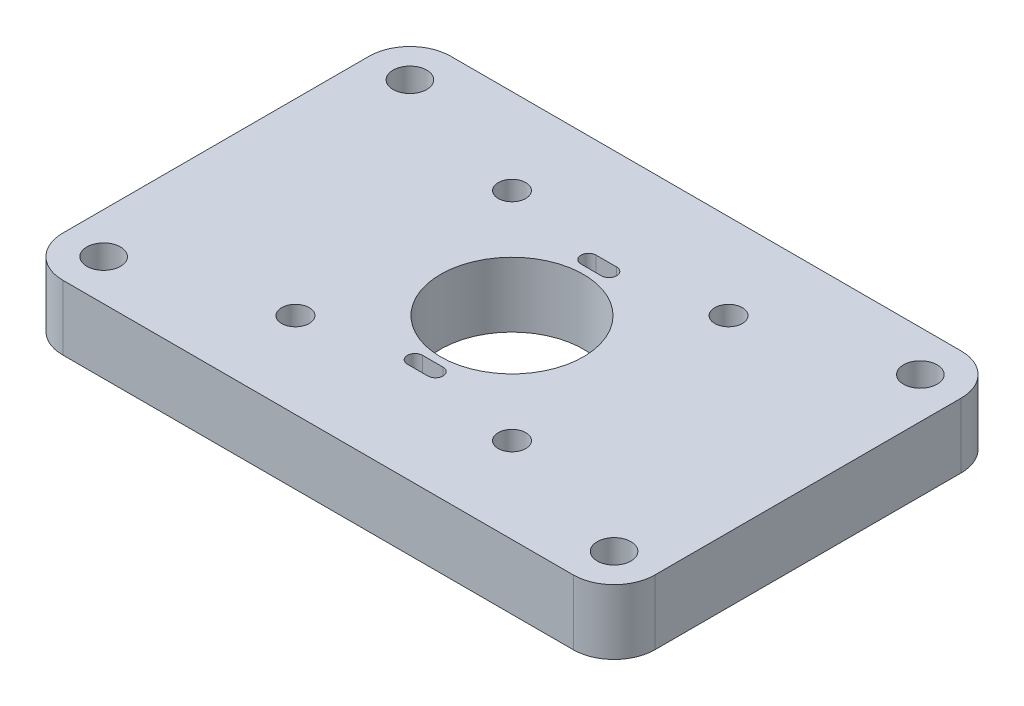
from build123d import *

# Parameters (mm, degrees)
SKETCH1_W           = 58
SKETCH1_H           = 38
SKETCH1_R           = 7
SKETCH1_R_2         = 1.65
BOSS_EXTRUDE1_DEPTH = 6.35
FILLET1_R           = 4
CUT_EXTRUDE1_DEPTH  = 65.127392743
SKETCH3_R           = 1.35
CUT_EXTRUDE2_DEPTH  = 65.127392743


with BuildPart() as part:
    # Sketch1 → Boss-Extrude1 (new body)
    with BuildSketch(Plane(origin=(0, 0, 0), x_dir=(1, 0, 0), z_dir=(0, 1, 0))):
        with Locations((25, 15)):
            Rectangle(SKETCH1_W, SKETCH1_H)
        with Locations(Location((25, 15, 0), (0, 0, 270))):
            Circle(SKETCH1_R, mode=Mode.SUBTRACT)
        with Locations(Location((0, 30, 0), (0, 0, 270))):
            Circle(SKETCH1_R_2, mode=Mode.SUBTRACT)
        with Locations(Location((50, 30, 0), (0, 0, 270))):
            Circle(SKETCH1_R_2, mode=Mode.SUBTRACT)
        with Locations(Location((50, 0, 0), (0, 0, 270))):
            Circle(SKETCH1_R_2, mode=Mode.SUBTRACT)
        with Locations(Location((0, 0, 0), (0, 0, 270))):
            Circle(SKETCH1_R_2, mode=Mode.SUBTRACT)
    extrude(amount=BOSS_EXTRUDE1_DEPTH)

    # Fillet1
    fillet1_edges = [part.edges().sort_by_distance(p)[0] for p in [
        (-4, 3.175, -34),
        (54, 3.175, -34),
        (54, 3.175, 4),
        (-4, 3.175, 4),
    ]]
    fillet(fillet1_edges, radius=FILLET1_R)

    # Sketch2 → Cut-Extrude1 (cut, through all)
    with BuildSketch(Plane(origin=(0, 6.35, 0), x_dir=(1, 0, 0), z_dir=(0, 1, 0))):
        with BuildLine():
            Line((24, 24.250000018), (26, 24.250000018))
            ThreePointArc((26, 24.250000018), (26.75, 23.500000018), (26, 22.750000018))
            Line((26, 22.750000018), (24, 22.750000018))
            ThreePointArc((24, 22.750000018), (23.25, 23.500000018), (24, 24.250000018))
        make_face()
        with BuildLine():
            Line((24, 5.749999982), (26, 5.749999982))
            ThreePointArc((26, 5.749999982), (26.75, 6.499999982), (26, 7.249999982))
            Line((26, 7.249999982), (24, 7.249999982))
            ThreePointArc((24, 7.249999982), (23.25, 6.499999982), (24, 5.749999982))
        make_face()
    extrude(amount=-CUT_EXTRUDE1_DEPTH, mode=Mode.SUBTRACT)

    # Sketch3 → Cut-Extrude2 (cut, through all)
    with BuildSketch(Plane(origin=(0, 6.35, 0), x_dir=(1, 0, 0), z_dir=(0, 1, 0))):
        with Locations(Location((35.606601718, 25.606601718, 0), (0, 0, 270))):
            Circle(SKETCH3_R)
        with Locations(Location((35.606601718, 4.393398282, 0), (0, 0, 270))):
            Circle(SKETCH3_R)
        with Locations(Location((14.393398282, 25.606601718, 0), (0, 0, 270))):
            Circle(SKETCH3_R)
        with Locations(Location((14.393398282, 4.393398282, 0), (0, 0, 270))):
            Circle(SKETCH3_R)
    extrude(amount=-CUT_EXTRUDE2_DEPTH, mode=Mode.SUBTRACT)


solid = part.part
